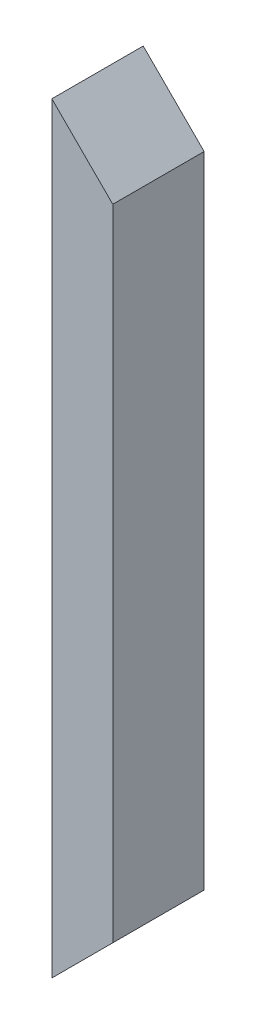
from build123d import *

# Parameters (mm, degrees)
BOSS_EXTRU_1_DEPTH = 30


with BuildPart() as part:
    # Esquisse1 → Boss.-Extru.1 (new body)
    with BuildSketch(Plane.XY):
        Polygon((-350, -100), (-350, -350), (-330, -330), (-330, -120), align=None)
    extrude(amount=BOSS_EXTRU_1_DEPTH)


solid = part.part
